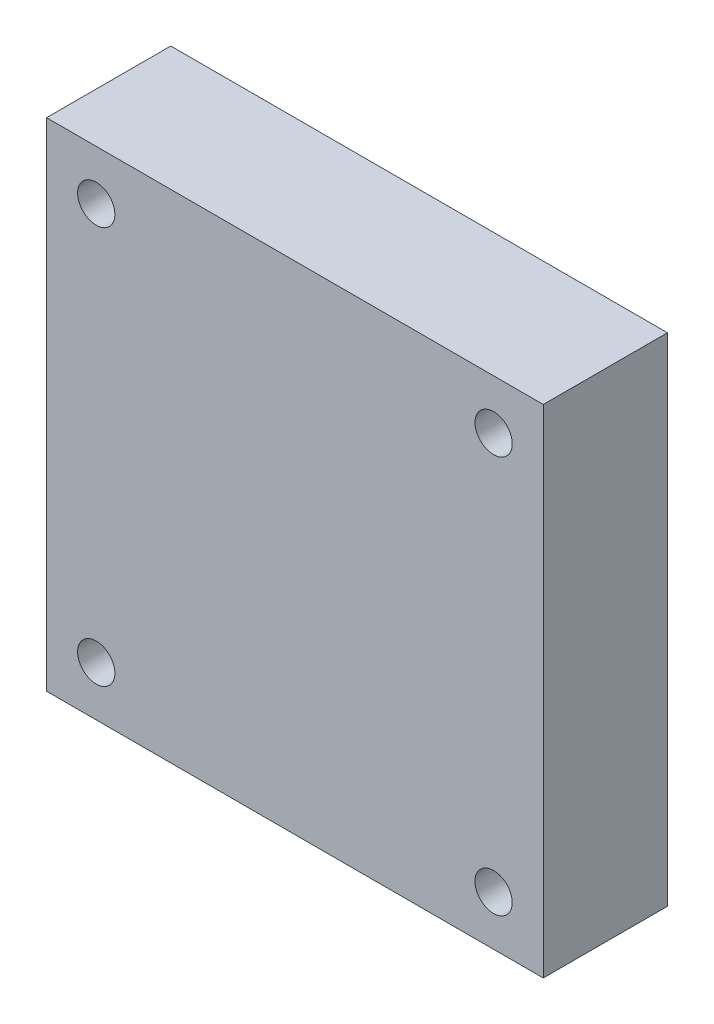
from build123d import *

# Parameters (mm, degrees)
ESQUISSE1_W        = 40
ESQUISSE1_H        = 40
ESQUISSE1_R        = 1.5
BOSS_EXTRU_1_DEPTH = 10


with BuildPart() as part:
    # Esquisse1 → Boss.-Extru.1 (new body)
    with BuildSketch(Plane.XY):
        Rectangle(ESQUISSE1_W, ESQUISSE1_H)
        with Locations((-16, 16)):
            Circle(ESQUISSE1_R, mode=Mode.SUBTRACT)
        with Locations(Location((16, 16, 0), (0, 0, 180))):
            Circle(ESQUISSE1_R, mode=Mode.SUBTRACT)
        with Locations((16, -16)):
            Circle(ESQUISSE1_R, mode=Mode.SUBTRACT)
        with Locations(Location((-16, -16, 0), (0, 0, 180))):
            Circle(ESQUISSE1_R, mode=Mode.SUBTRACT)
    extrude(amount=BOSS_EXTRU_1_DEPTH)


solid = part.part
